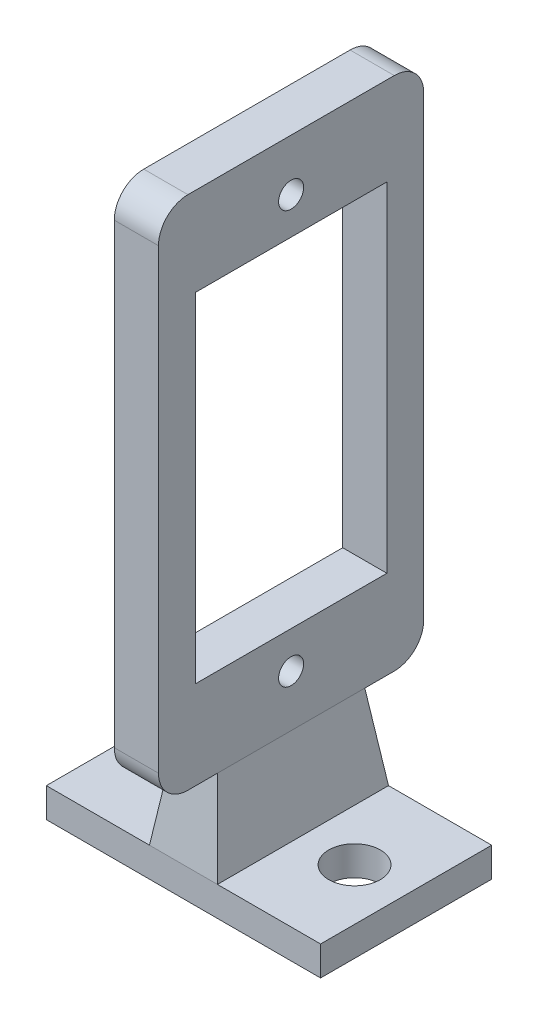
from build123d import *

# Parameters (mm, degrees)
ESBO_O1_W                = 18
ESBO_O1_H                = 35
RESSALTO_EXTRUS_O1_DEPTH = 1.5
CORTE_EXTRUS_O1_REACH    = 21.906
ESBO_O2_W                = 13
ESBO_O2_H                = 23
CORTE_EXTRUS_O2_REACH    = 21.906
ESBO_O3_R                = 0.85
FILETE1_R                = 2
ESBO_O4_W                = 3
ESBO_O4_H                = 10
RESSALTO_EXTRUS_O2_DEPTH = 5.73
RESSALTO_EXTRUS_O2_DRAFT = -8
ESBO_O5_W                = 18.610597966
ESBO_O5_H                = 11.610597966
RESSALTO_EXTRUS_O3_DEPTH = 2
CORTE_EXTRUS_O4_REACH    = 46.648
ESBO_O7_R                = 1.75


with BuildPart() as part:
    # Esboço1 → Ressalto-extrusão1 (new, symmetric)
    with BuildSketch(Plane(origin=(0, 0, 0), x_dir=(0, 0, -1), z_dir=(1, 0, 0))):
        Rectangle(ESBO_O1_W, ESBO_O1_H)
    extrude(amount=RESSALTO_EXTRUS_O1_DEPTH, both=True)

    # Esboço2 → Corte-extrusão1 (cut, up to next)
    with BuildSketch(Plane(origin=(1.5, 0, 0), x_dir=(0, 0, -1), z_dir=(1, 0, 0)), mode=Mode.PRIVATE) as corte_extrus_o1_sk1:
        Rectangle(ESBO_O2_W, ESBO_O2_H)
    corte_extrus_o1_tool1 = extrude(corte_extrus_o1_sk1.sketch, amount=-CORTE_EXTRUS_O1_REACH, mode=Mode.PRIVATE) & part.part
    add(corte_extrus_o1_tool1.solids().sort_by_distance((1.5, 0, 0))[0], mode=Mode.SUBTRACT)

    # Esboço3 → Corte-extrusão2 (cut, up to next)
    with BuildSketch(Plane.ZY.offset(1.5), mode=Mode.PRIVATE) as corte_extrus_o2_sk1:
        with Locations((0, 14)):
            Circle(ESBO_O3_R)
    corte_extrus_o2_tool1 = extrude(corte_extrus_o2_sk1.sketch, amount=-CORTE_EXTRUS_O2_REACH, mode=Mode.PRIVATE) & part.part
    # Esboço3 → Corte-extrusão2 (cut, up to next)
    with BuildSketch(Plane.ZY.offset(1.5), mode=Mode.PRIVATE) as corte_extrus_o2_sk2:
        with Locations((0, -14)):
            Circle(ESBO_O3_R)
    corte_extrus_o2_tool2 = extrude(corte_extrus_o2_sk2.sketch, amount=-CORTE_EXTRUS_O2_REACH, mode=Mode.PRIVATE) & part.part
    add(corte_extrus_o2_tool1.solids().sort_by_distance((-1.5, 14, 0))[0], mode=Mode.SUBTRACT)
    add(corte_extrus_o2_tool2.solids().sort_by_distance((-1.5, -14, 0))[0], mode=Mode.SUBTRACT)

    # Filete1
    filete1_edges = [part.edges().sort_by_distance(p)[0] for p in [
        (0, -17.5, -9),
        (0, -17.5, 9),
        (0, 17.5, 9),
        (0, 17.5, -9),
    ]]
    fillet(filete1_edges, radius=FILETE1_R)


with BuildPart() as ressalto_extrus_o2_tool:
    # Esboço4 → Ressalto-extrusão2 (with draft: the straight prism first)
    with BuildSketch(Plane.XZ.offset(17.5)):
        Rectangle(ESBO_O4_W, ESBO_O4_H)
    extrude(amount=RESSALTO_EXTRUS_O2_DEPTH)
    # Ressalto-extrusão2: the draft: its side faces are tilted about the plane it starts from
    ressalto_extrus_o2_sides = [ressalto_extrus_o2_tool.faces().sort_by_distance(p)[0] for p in [
        (0, -20.365, -5),
        (1.5, -20.365, 0),
        (0, -20.365, 5),
        (-1.5, -20.365, 0),
    ]]
    draft(ressalto_extrus_o2_sides, Plane.XZ.offset(17.5), RESSALTO_EXTRUS_O2_DRAFT)


with BuildPart() as part_1:
    add(part.part)

    # Ressalto-extrusão2: add ressalto_extrus_o2_tool
    add(ressalto_extrus_o2_tool.part)

    # Esboço5 → Ressalto-extrusão3 (add)
    with BuildSketch(Plane.XZ.offset(23.23)):
        Rectangle(ESBO_O5_W, ESBO_O5_H)
    extrude(amount=RESSALTO_EXTRUS_O3_DEPTH)

    # Esboço7 → Corte-extrusão4 (cut, up to next)
    with BuildSketch(Plane.XZ.offset(25.23), mode=Mode.PRIVATE) as corte_extrus_o4_sk1:
        with Locations(Location((-5.805298983, 0, 0), (0, 0, 270))):
            Circle(ESBO_O7_R)
    corte_extrus_o4_tool1 = extrude(corte_extrus_o4_sk1.sketch, amount=-CORTE_EXTRUS_O4_REACH, mode=Mode.PRIVATE) & part_1.part
    # Esboço7 → Corte-extrusão4 (cut, up to next)
    with BuildSketch(Plane.XZ.offset(25.23), mode=Mode.PRIVATE) as corte_extrus_o4_sk2:
        with Locations(Location((5.805298983, 0, 0), (0, 0, 270))):
            Circle(ESBO_O7_R)
    corte_extrus_o4_tool2 = extrude(corte_extrus_o4_sk2.sketch, amount=-CORTE_EXTRUS_O4_REACH, mode=Mode.PRIVATE) & part_1.part
    add(corte_extrus_o4_tool1.solids().sort_by_distance((-5.805299, -25.23, 0))[0], mode=Mode.SUBTRACT)
    add(corte_extrus_o4_tool2.solids().sort_by_distance((5.805299, -25.23, 0))[0], mode=Mode.SUBTRACT)


solid = part_1.part
